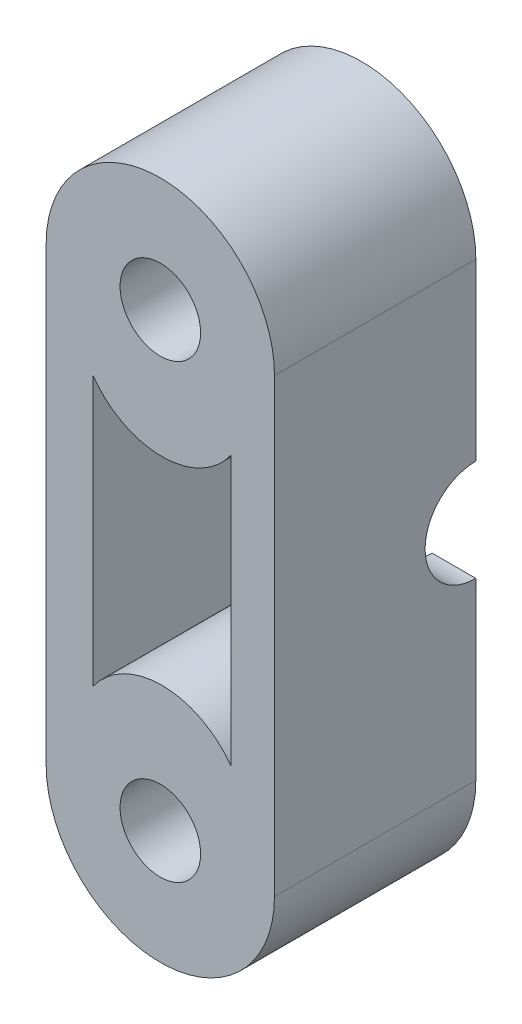
from build123d import *

# Parameters (mm, degrees)
ESQUISSE1_R             = 1
EXTRUSION1_DEPTH        = 5
ESQUISSE2_R             = 1.259960856
ENL_V_MAT_EXTRU_1_DEPTH = 15
ESQUISSE3_R             = 2
ENL_V_MAT_EXTRU_2_DEPTH = 3


with BuildPart() as part:
    # Esquisse1 → Extrusion1 (new body)
    with BuildSketch(Plane.XY):
        with BuildLine():
            Line((-30.206178794, 71.120250568), (-30.206178794, 59.916517686))
            ThreePointArc((-30.206178794, 59.916517686), (-27.371580774, 57.081919667), (-24.536982754, 59.916517686))
            Line((-24.536982754, 59.916517686), (-24.536982754, 71.120250568))
            ThreePointArc((-24.536982754, 71.120250568), (-27.371580774, 73.954848588), (-30.206178794, 71.120250568))
        make_face()
        with Locations((-27.371580774, 59.916517686)):
            Circle(ESQUISSE1_R, mode=Mode.SUBTRACT)
        with Locations((-27.371580774, 71.120250568)):
            Circle(ESQUISSE1_R, mode=Mode.SUBTRACT)
        with BuildLine():
            Line((-29.038880927, 68.862401416), (-29.038880927, 62.190489948))
            ThreePointArc((-29.038880927, 62.190489948), (-27.330220673, 63.062743756), (-25.621560419, 62.190489948))
            Line((-25.621560419, 62.190489948), (-25.621560419, 68.862401416))
            ThreePointArc((-25.621560419, 68.862401416), (-27.330220673, 67.980247638), (-29.038880927, 68.862401416))
        make_face(mode=Mode.SUBTRACT)
    extrude(amount=EXTRUSION1_DEPTH)

    # Esquisse2 → Enlèv. mat.-Extru.1 (cut)
    with BuildSketch(Plane(origin=(-24.536982754, 0, 0), x_dir=(0, 0, -1), z_dir=(1, 0, 0))):
        with Locations((0, 65.518384127)):
            Circle(ESQUISSE2_R)
    extrude(amount=-ENL_V_MAT_EXTRU_1_DEPTH, mode=Mode.SUBTRACT)

    # Esquisse3 → Enlèv. mat.-Extru.2 (cut)
    with BuildSketch(Plane(origin=(0, 0, 0), x_dir=(-1, 0, 0), z_dir=(0, 0, -1))):
        with Locations((27.371580774, 71.120250568)):
            Circle(ESQUISSE3_R)
        with Locations((27.371580774, 59.916517686)):
            Circle(ESQUISSE3_R)
    extrude(amount=-ENL_V_MAT_EXTRU_2_DEPTH, mode=Mode.SUBTRACT)


solid = part.part
